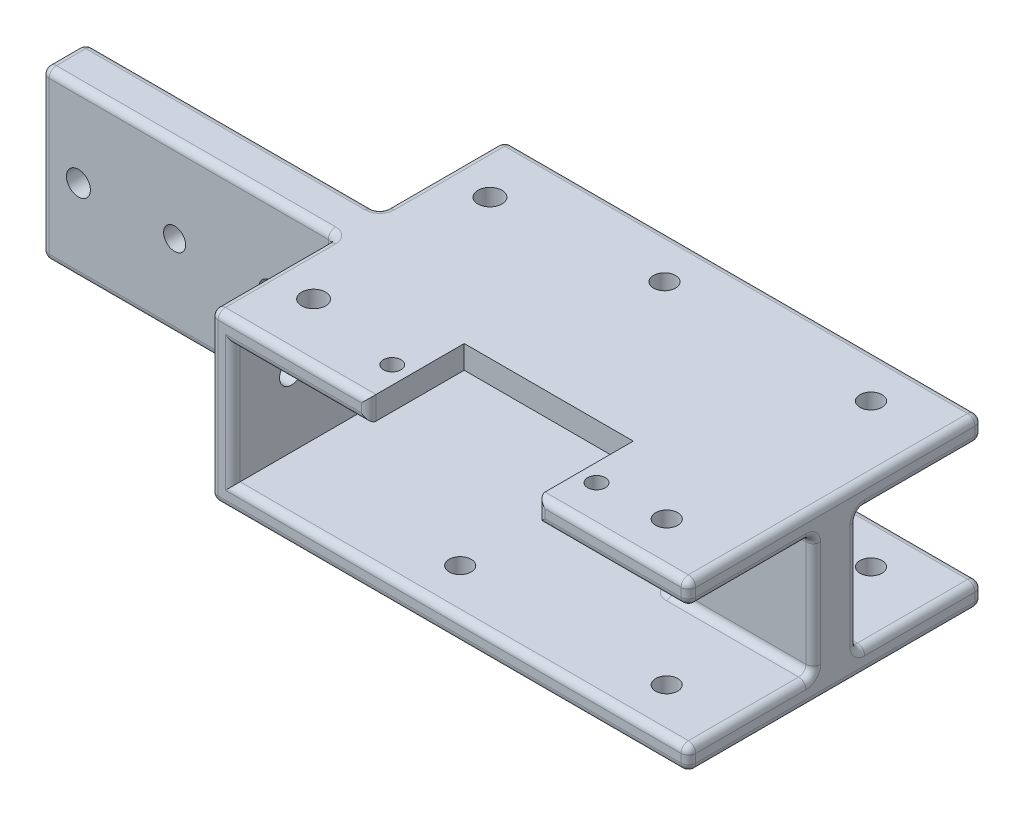
from build123d import *

# Parameters (mm, degrees)
SKETCH1_W                 = 65
SKETCH1_H                 = 40
BOSS_EXTRUDE1_DEPTH       = 3.15
BOSS_EXTRUDE2_START       = 16.4
SKETCH1_2_W               = 65
SKETCH1_2_H               = 40
BOSS_EXTRUDE2_DEPTH       = 3.15
SKETCH2_W                 = 3
SKETCH2_H                 = 40
SKETCH2_W_2               = 20
SKETCH2_H_2               = 6
BOSS_EXTRUDE3_DEPTH       = 16.4
SKETCH3_W                 = 6
SKETCH3_H                 = 22.7
BOSS_EXTRUDE4_DEPTH       = 40
M2_CLEARANCE_HOLE1_D      = 2.4
M2_CLEARANCE_HOLE1_DEPTH  = 5
M2_CLEARANCE_HOLE1_TIP    = 0.721032743
F_3_0MM_DOWEL_HOLE1_D     = 3
SKETCH5_W                 = 23
SKETCH5_H                 = 13
CUT_EXTRUDE1_DEPTH        = 7
FILLET1_R                 = 1
F_4_CLEARANCE_HOLE1_D     = 3.2639
F_3_0MM_DOWEL_HOLE2_D     = 3
F_4_CLEARANCE_HOLE2_D     = 3.2639
F_4_CLEARANCE_HOLE2_DEPTH = 10
F_4_CLEARANCE_HOLE2_TIP   = 0.980574487
F_4_CLEARANCE_HOLE3_D     = 3.2639


with BuildPart() as part:
    # Sketch1 → Boss-Extrude1 (new body)
    with BuildSketch(Plane(origin=(0, 0, 0), x_dir=(1, 0, 0), z_dir=(0, 1, 0))):
        with Locations((32.5, 0)):
            Rectangle(SKETCH1_W, SKETCH1_H)
    extrude(amount=-BOSS_EXTRUDE1_DEPTH)



with BuildPart() as body_2:
    # Sketch1<2> → Boss-Extrude2 (new body)
    with BuildSketch(Plane(origin=(0, 0, 0), x_dir=(1, 0, 0), z_dir=(0, 1, 0)).offset(BOSS_EXTRUDE2_START)):
        with Locations((32.5, 0)):
            Rectangle(SKETCH1_2_W, SKETCH1_2_H)
    extrude(amount=BOSS_EXTRUDE2_DEPTH)


with BuildPart() as part_1:
    add(part.part)

    add(body_2.part)  # Boss-Extrude3 merges body 2
    # Sketch2 → Boss-Extrude3 (add)
    with BuildSketch(Plane(origin=(0, 0, 0), x_dir=(1, 0, 0), z_dir=(0, 1, 0))):
        with Locations((1.5, 0)):
            Rectangle(SKETCH2_W, SKETCH2_H)
        with Locations((55, 0)):
            Rectangle(SKETCH2_W_2, SKETCH2_H_2)
    extrude(amount=BOSS_EXTRUDE3_DEPTH)

    # Sketch3 → Boss-Extrude4 (add)
    with BuildSketch(Plane.ZY):
        with Locations((0, 8.2)):
            Rectangle(SKETCH3_W, SKETCH3_H)
    extrude(amount=BOSS_EXTRUDE4_DEPTH)

    # M2 Clearance Hole1
    with Locations(Plane(origin=(0, 19.55, 0), x_dir=(1, 0, 0), z_dir=(0, 1, 0))):
        with Locations((19.1, -14.4), (46.9, -14.4)):
            Hole(M2_CLEARANCE_HOLE1_D / 2, depth=M2_CLEARANCE_HOLE1_DEPTH)
            with Locations((0, 0, -(M2_CLEARANCE_HOLE1_DEPTH + M2_CLEARANCE_HOLE1_TIP / 2))):  # 118° drill point
                Cone(0, M2_CLEARANCE_HOLE1_D / 2, M2_CLEARANCE_HOLE1_TIP, mode=Mode.SUBTRACT)

    # Ø3.0mm Dowel Hole1 (through all)
    with Locations(Plane(origin=(0, 19.55, 0), x_dir=(1, 0, 0), z_dir=(0, 1, 0))):
        with Locations((55.95, -13.9), (27.85, 13.9), (55.95, 13.9), (27.85, -13.9)):
            Hole(F_3_0MM_DOWEL_HOLE1_D / 2)

    # Sketch5 → Cut-Extrude1 (cut)
    with BuildSketch(Plane(origin=(0, 19.55, 0), x_dir=(1, 0, 0), z_dir=(0, 1, 0))):
        with Locations((33, -13.5)):
            Rectangle(SKETCH5_W, SKETCH5_H)
    extrude(amount=-CUT_EXTRUDE1_DEPTH, mode=Mode.SUBTRACT)

    # Fillet1
    fillet1_edges = [part_1.edges().sort_by_distance(p)[0] for p in [
        (65, -3.15, 0),
        (54.75, 19.55, 20),
        (54.75, 16.4, 20),
        (21.5, 17.975, 20),
        (44.5, 17.975, 20),
        (32.5, -3.15, -20),
        (34, 0, 20),
        (3, 8.2, 20),
        (3, 8.2, -20),
        (12.25, 16.4, 20),
        (65, 16.4, 11.5),
        (65, 17.975, 20),
        (34, 16.4, -20),
        (65, 17.975, -20),
        (0, 19.55, -11.5),
        (10.75, 19.55, 20),
        (65, 19.55, 0),
        (32.5, 19.55, -20),
        (65, 16.4, -11.5),
        (65, 0, -11.5),
        (65, 8.2, 3),
        (65, 8.2, -3),
        (55, 0, -3),
        (45, 8.2, -3),
        (45, 0, 0),
        (45, 8.2, 3),
        (55, 0, 3),
        (55, 16.4, 3),
        (55, 16.4, -3),
        (45, 16.4, 0),
        (0, -3.15, -11.5),
        (34, 0, -20),
        (0, 19.55, 11.5),
        (0, -3.15, 11.5),
        (65, 0, 11.5),
        (0, 8.2, -3),
        (-20, 19.55, -3),
        (-20, -3.15, -3),
        (0, 8.2, 3),
        (-20, -3.15, 3),
        (-20, 19.55, 3),
        (-40, 8.2, -3),
        (-40, -3.15, 0),
        (-40, 8.2, 3),
        (-40, 19.55, 0),
        (32.5, -3.15, 20),
        (0, 8.2, -20),
        (65, -1.575, -20),
        (65, -1.575, 20),
        (0, 8.2, 20),
    ]]
    fillet(fillet1_edges, radius=FILLET1_R)

    # #4 Clearance Hole1 (through all)
    with Locations(Plane.XY.offset(3)):
        with Locations((-35, 8.2), (-8.82, 8.2)):
            Hole(F_4_CLEARANCE_HOLE1_D / 2)

    # Ø3.0mm Dowel Hole2 (through all)
    with Locations(Plane.XY.offset(3)):
        with Locations((-21.91, 8.2)):
            Hole(F_3_0MM_DOWEL_HOLE2_D / 2)

    # #4 Clearance Hole2
    with Locations(Plane(origin=(0, 19.55, 0), x_dir=(1, 0, 0), z_dir=(0, 1, 0))):
        with Locations((6, 12), (6, -12)):
            Hole(F_4_CLEARANCE_HOLE2_D / 2, depth=F_4_CLEARANCE_HOLE2_DEPTH)
            with Locations((0, 0, -(F_4_CLEARANCE_HOLE2_DEPTH + F_4_CLEARANCE_HOLE2_TIP / 2))):  # 118° drill point
                Cone(0, F_4_CLEARANCE_HOLE2_D / 2, F_4_CLEARANCE_HOLE2_TIP, mode=Mode.SUBTRACT)

    # #4 Clearance Hole3 (through all)
    with Locations(Plane.ZY):
        with Locations((-12, 9.55), (12, 9.55)):
            Hole(F_4_CLEARANCE_HOLE3_D / 2)


solid = part_1.part
